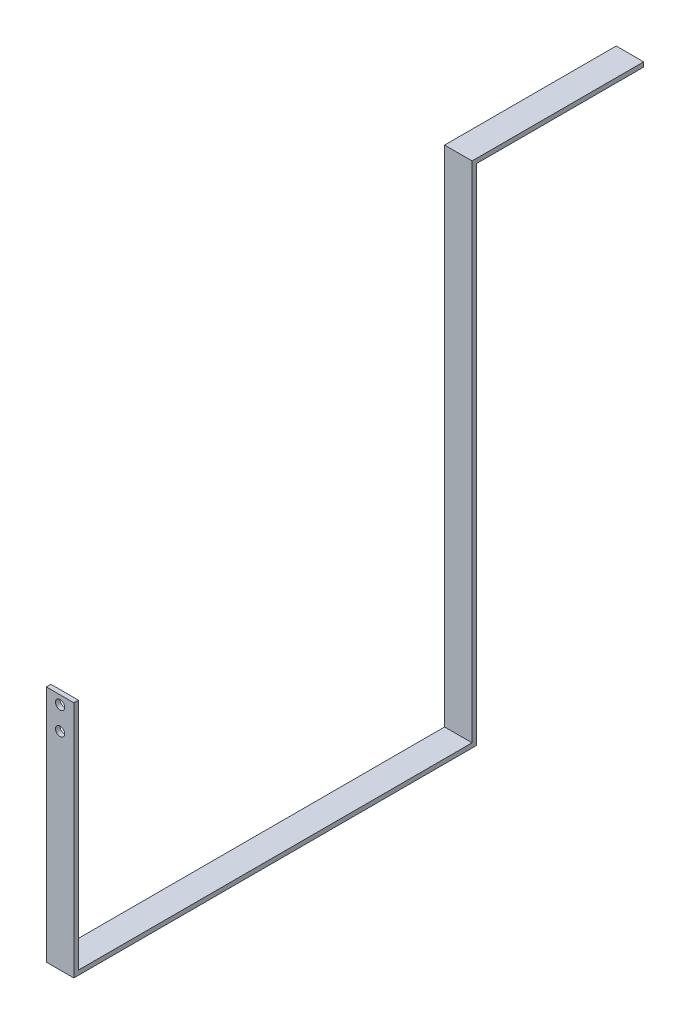
from build123d import *

# Parameters (mm, degrees)
CROQUIS1_W              = 38.1
CROQUIS1_H              = 6.31
SALIENTE_EXTRUIR1_DEPTH = 238.05
CROQUIS2_W              = 38.1
CROQUIS2_H              = 6.31
SALIENTE_EXTRUIR2_DEPTH = 699.1
CROQUIS3_W              = 38.1
CROQUIS3_H              = 6.31
SALIENTE_EXTRUIR3_DEPTH = 552.5
CROQUIS4_W              = 38.1
CROQUIS4_H              = 6.31
SALIENTE_EXTRUIR4_DEPTH = 324.39
CROQUIS5_R              = 6.35
CORTAR_EXTRUIR1_DEPTH   = 6.31


with BuildPart() as part:
    # Croquis1 → Saliente-Extruir1 (new body)
    with BuildSketch(Plane.XY):
        Rectangle(CROQUIS1_W, CROQUIS1_H)
    extrude(amount=SALIENTE_EXTRUIR1_DEPTH)

    # Croquis2 → Saliente-Extruir2 (add)
    with BuildSketch(Plane.XZ.offset(3.155)):
        with Locations((0, 234.895)):
            Rectangle(CROQUIS2_W, CROQUIS2_H)
    extrude(amount=SALIENTE_EXTRUIR2_DEPTH)

    # Croquis3 → Saliente-Extruir3 (add)
    with BuildSketch(Plane.XY.offset(238.05)):
        with Locations((0, -699.1)):
            Rectangle(CROQUIS3_W, CROQUIS3_H)
    extrude(amount=SALIENTE_EXTRUIR3_DEPTH)

    # Croquis4 → Saliente-Extruir4 (add)
    with BuildSketch(Plane(origin=(0, -695.945, 0), x_dir=(1, 0, 0), z_dir=(0, 1, 0))):
        with Locations((0, -787.395)):
            Rectangle(CROQUIS4_W, CROQUIS4_H)
    extrude(amount=SALIENTE_EXTRUIR4_DEPTH)

    # Croquis5 → Cortar-Extruir1 (cut)
    with BuildSketch(Plane.XY.offset(790.55)):
        with Locations((0, -383.447204666)):
            Circle(CROQUIS5_R)
        with Locations((0, -415.447204666)):
            Circle(CROQUIS5_R)
    extrude(amount=-CORTAR_EXTRUIR1_DEPTH, mode=Mode.SUBTRACT)


solid = part.part
